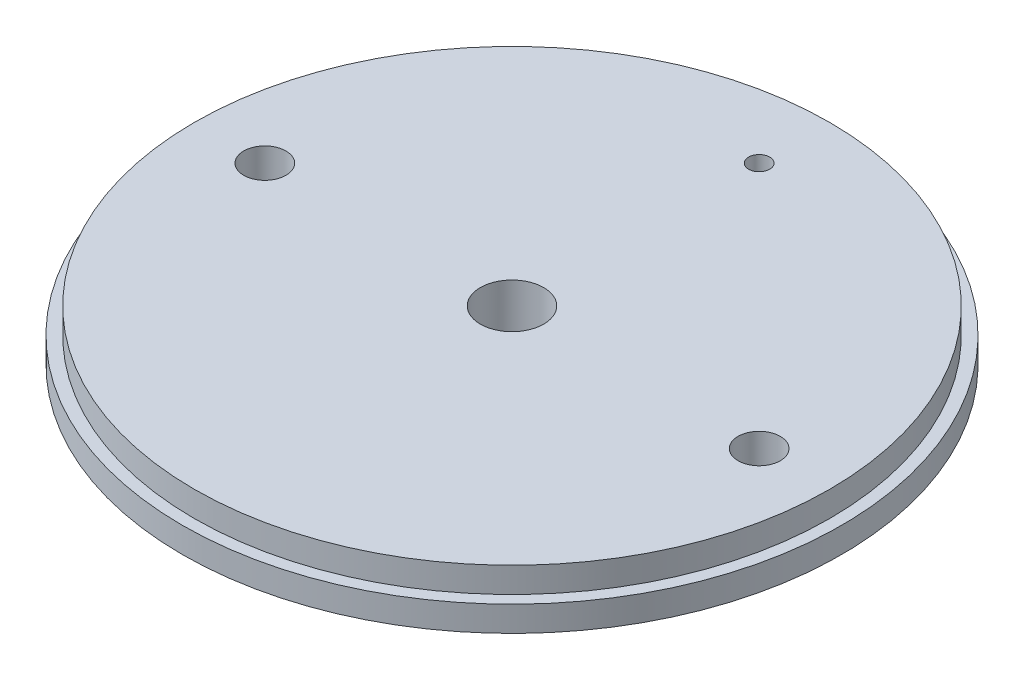
from build123d import *

# Parameters (mm, degrees)
SKETCH9_R           = 49.53
BOSS_EXTRUDE1_DEPTH = 3.81
SKETCH10_R          = 47.752
BOSS_EXTRUDE2_DEPTH = 3.81
SKETCH11_R          = 3.175
SKETCH11_R_2        = 4.7625
CUT_EXTRUDE1_DEPTH  = 10.922
SKETCH11_3_R        = 3.175
SKETCH11_3_R_2      = 1.5875
CUT_EXTRUDE2_DEPTH  = 40.64


with BuildPart() as part:
    # Sketch9 → Boss-Extrude1 (new body)
    with BuildSketch(Plane(origin=(0, 0, 0), x_dir=(1, 0, 0), z_dir=(0, 1, 0))):
        Circle(SKETCH9_R)
    extrude(amount=BOSS_EXTRUDE1_DEPTH)

    # Sketch10 → Boss-Extrude2 (add)
    with BuildSketch(Plane(origin=(0, 3.81, 0), x_dir=(1, 0, 0), z_dir=(0, 1, 0))):
        Circle(SKETCH10_R)
    extrude(amount=BOSS_EXTRUDE2_DEPTH)

    # Sketch11 → Cut-Extrude1 (cut)
    with BuildSketch(Plane(origin=(0, 0, 0), x_dir=(-1, 0, 0), z_dir=(0, -1, 0))):
        with Locations((37.1475, 0)):
            Circle(SKETCH11_R)
        with Locations((-37.1475, 0)):
            Circle(SKETCH11_R)
        Circle(SKETCH11_R_2)
    extrude(amount=-CUT_EXTRUDE1_DEPTH, mode=Mode.SUBTRACT)

    # Sketch11<3> → Cut-Extrude2 (cut)
    with BuildSketch(Plane(origin=(0, 0, 0), x_dir=(-1, 0, 0), z_dir=(0, -1, 0))):
        with Locations((37.1475, 0)):
            Circle(SKETCH11_3_R)
        with Locations((0, 37.1475)):
            Circle(SKETCH11_3_R_2)
        with Locations((-37.1475, 0)):
            Circle(SKETCH11_3_R)
    extrude(amount=-CUT_EXTRUDE2_DEPTH, mode=Mode.SUBTRACT)


solid = part.part
